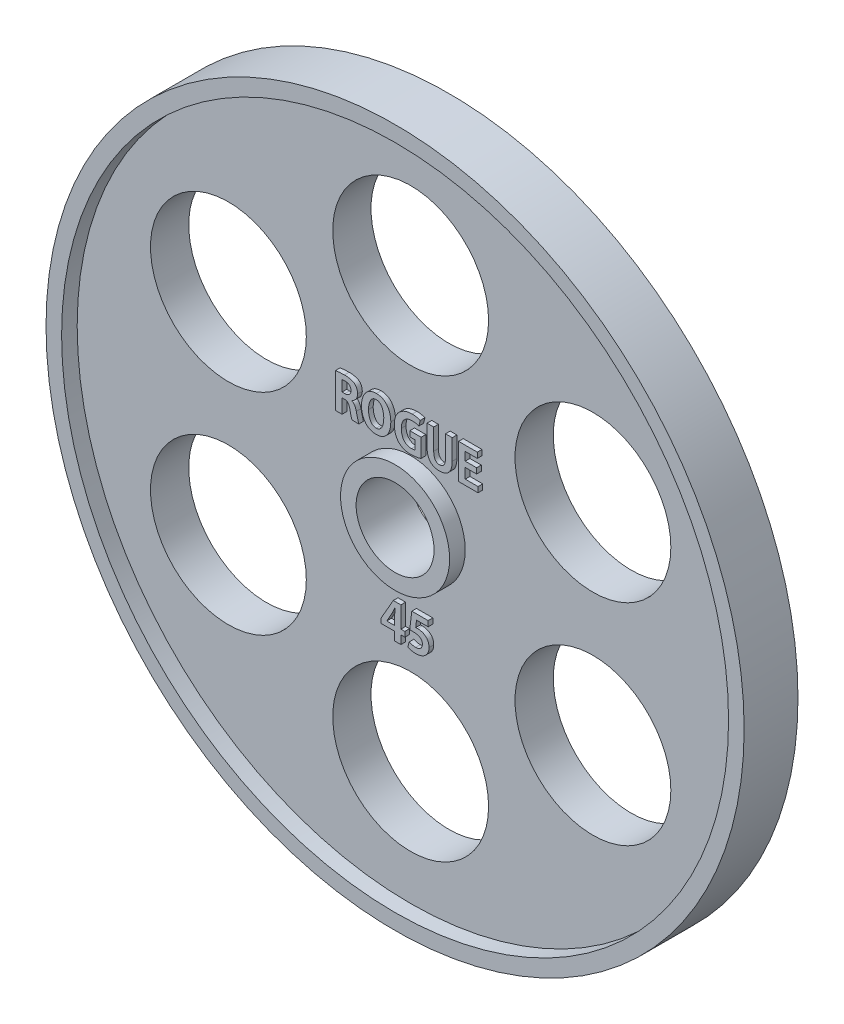
from build123d import *

# Parameters (mm, degrees)
SKETCH1_R               = 224
SKETCH1_R_2             = 25
BOSS_EXTRUDE1_DEPTH     = 17.272
SKETCH2_R               = 214
SKETCH2_R_2             = 35
CUT_EXTRUDE1_DEPTH      = 10
CUT_EXTRUDE2_DEPTH      = 318.733233918
CUT_EXTRUDE2_DEPTH_BACK = 318.733233918
SKETCH3_R               = 50
BOSS_EXTRUDE2_DEPTH     = 3


with BuildPart() as part:
    # Sketch1 → Boss-Extrude1 (new, symmetric)
    with BuildSketch(Plane.XY):
        Circle(SKETCH1_R)
        Circle(SKETCH1_R_2, mode=Mode.SUBTRACT)
    extrude(amount=BOSS_EXTRUDE1_DEPTH, both=True)

    # Sketch2 → Cut-Extrude1 (cut)
    with BuildSketch(Plane.XY.offset(17.272)):
        Circle(SKETCH2_R)
        Circle(SKETCH2_R_2, mode=Mode.SUBTRACT)
    extrude(amount=-CUT_EXTRUDE1_DEPTH, mode=Mode.SUBTRACT)

    # Sketch3 → Cut-Extrude2 (cut, two sides: drawn at the far end of the back side and taken through both)
    with BuildSketch(Plane.XY.offset(7.272).offset(-CUT_EXTRUDE2_DEPTH_BACK)):
        with Locations((0, 135.049061033)):
            Circle(SKETCH3_R)
        with Locations((116.955917612, 67.524530516)):
            Circle(SKETCH3_R)
        with Locations((116.955917612, -67.524530516)):
            Circle(SKETCH3_R)
        with Locations((0, -135.049061033)):
            Circle(SKETCH3_R)
        with Locations((-116.955917612, -67.524530516)):
            Circle(SKETCH3_R)
        with Locations((-116.955917612, 67.524530516)):
            Circle(SKETCH3_R)
    extrude(amount=CUT_EXTRUDE2_DEPTH + CUT_EXTRUDE2_DEPTH_BACK, mode=Mode.SUBTRACT)

    # Sketch4 → Boss-Extrude2 (add)
    # profile 1 of 7: a face of its own
    with BuildSketch(Plane.XY.offset(7.272)):
        Polygon((-0.729760641, -64.783991766), (-0.729760641, -61.581212386), (-3.263971384, -61.581212386), (-3.263971384, -48.102699124), (-8.128490856, -48.102699124), (-16.138927113, -62.038586506), (-16.138927113, -64.783991766), (-7.254625082, -64.783991766), (-7.254625082, -70.178139579), (-3.263971384, -70.178139579), (-3.263971384, -64.783991766), align=None)
        with BuildLine():
            add(Edge.make_bspline(
                [(-9.060614348, -55.820957862), (-8.89815638, -55.501607627), (-8.573533112, -54.863482464), (-8.123898036, -53.878632946), (-7.672922402, -52.865658152), (-7.358712998, -52.183255973), (-7.197815988, -51.833818721)],
                knots=[0, 0, 0, 0, 0.976764423, 1.951769216, 2.951163759, 4, 4, 4, 4], degree=3))
            Line((-7.197815988, -51.833818721), (-7.079851928, -51.831193091))
            add(Edge.make_bspline(
                [(-7.079851928, -51.831193091), (-7.126170714, -52.520143902), (-7.218214105, -53.889207629), (-7.244003181, -55.26111613), (-7.25681448, -55.942642251)],
                knots=[0, 0, 0, 0, 1.006455431, 2, 2, 2, 2], degree=3))
            Line((-7.25681448, -55.942642251), (-7.254625082, -61.581212386))
            Line((-7.254625082, -61.581212386), (-12.29391771, -61.581212386))
            Line((-12.29391771, -61.581212386), (-12.29391771, -61.521209735))
            Line((-12.29391771, -61.521209735), (-9.060614348, -55.820957862))
        make_face(mode=Mode.SUBTRACT)
    # profile 2 of 7: a face of its own
    with BuildSketch(Plane.XY.offset(7.272)):
        with BuildLine():
            add(Edge.make_bspline(
                [(2.379360279, -59.23721581), (2.559579298, -59.216358066), (2.938471092, -59.172506825), (3.532540352, -59.135035855), (4.177287829, -59.101641828), (4.622899626, -59.09994457), (4.854733032, -59.099061557)],
                knots=[0, 0, 0, 0, 0.877454455, 1.844756985, 2.878716113, 4, 4, 4, 4], degree=3))
            add(Edge.make_bspline(
                [(4.854733032, -59.099061557), (5.080989396, -59.10211444), (5.520052296, -59.108038726), (6.157616705, -59.158861274), (6.751381372, -59.242672102), (7.303991216, -59.355254428), (7.812791258, -59.501736346), (8.281436233, -59.67937668), (8.708420394, -59.887738259), (9.089837497, -60.134764703), (9.429954537, -60.407980364), (9.723273344, -60.714933789), (9.973074694, -61.048437776), (10.178440086, -61.410482449), (10.333708042, -61.802528085), (10.448419054, -62.221990978), (10.515361186, -62.670564206), (10.525861767, -62.978695119), (10.531230769, -63.136244061)],
                knots=[0, 0, 0, 0, 1.376975805, 2.672097174, 3.889715345, 5.024935981, 6.101897443, 7.108622118, 8.072196835, 8.987646619, 9.868961103, 10.721607246, 11.564639608, 12.399262134, 13.247093457, 14.1244591, 15.041026163, 16, 16, 16, 16], degree=3))
            add(Edge.make_bspline(
                [(10.531230769, -63.136244061), (10.523058413, -63.286880314), (10.507085227, -63.581304684), (10.432041756, -64.00807688), (10.330997718, -64.411264541), (10.180871979, -64.783078556), (9.997726406, -65.12945145), (9.779149199, -65.450624894), (9.520064898, -65.743748283), (9.224101576, -66.002824757), (8.904010678, -66.233724235), (8.565617006, -66.436556164), (8.212412643, -66.610632098), (7.842442157, -66.74690259), (7.461712287, -66.867101), (7.06046104, -66.936077496), (6.647298729, -66.992046532), (6.366426644, -66.997756663), (6.224340875, -67.000645267)],
                knots=[0, 0, 0, 0, 1.117583691, 2.184360454, 3.207534369, 4.193945161, 5.149122039, 6.108265851, 7.067522763, 8.041482217, 9.018611016, 9.990340196, 10.963909721, 11.93306774, 12.911749652, 13.918839882, 14.947196064, 16, 16, 16, 16], degree=3))
            add(Edge.make_bspline(
                [(6.224340875, -67.000645267), (6.013473837, -66.99500088), (5.597844617, -66.983875517), (4.986800857, -66.919530955), (4.399845454, -66.818901558), (3.842490249, -66.682702097), (3.323666611, -66.530129827), (2.851866447, -66.363676994), (2.43213169, -66.195988197), (2.176551499, -66.066781086), (2.056518854, -66.006099264)],
                knots=[0, 0, 0, 0, 1.17104461, 2.308186058, 3.408530927, 4.475634886, 5.492545615, 6.410316856, 7.253408985, 8, 8, 8, 8], degree=3))
            Line((2.056518854, -66.006099264), (1.214205915, -69.272087198))
            add(Edge.make_bspline(
                [(1.214205915, -69.272087198), (1.363191124, -69.348995251), (1.676368677, -69.510661472), (2.196057613, -69.714959315), (2.782697668, -69.901851195), (3.431591554, -70.077757556), (4.132156302, -70.232001255), (4.876691775, -70.330758892), (5.653812217, -70.409031539), (6.184792397, -70.417983419), (6.456120664, -70.422557786)],
                knots=[0, 0, 0, 0, 0.742744707, 1.56130243, 2.470949386, 3.470792521, 4.54051912, 5.647308622, 6.797786247, 8, 8, 8, 8], degree=3))
            add(Edge.make_bspline(
                [(6.456120664, -70.422557786), (6.774012692, -70.409607099), (7.393776054, -70.384358397), (8.295395465, -70.258547525), (9.144462304, -70.07547066), (9.941409611, -69.827727478), (10.68364529, -69.511378566), (11.369985643, -69.124491469), (12.005829161, -68.677451563), (12.582253299, -68.165853445), (13.098116991, -67.608878026), (13.547790717, -67.013382942), (13.935759145, -66.389389475), (14.244459114, -65.727885737), (14.499088618, -65.041661337), (14.673173956, -64.320169842), (14.786005396, -63.568180767), (14.803804761, -63.055177336), (14.812835596, -62.794895644)],
                knots=[0, 0, 0, 0, 1.206264818, 2.351737923, 3.448157932, 4.498117667, 5.51266174, 6.502772445, 7.481504261, 8.455495724, 9.420819422, 10.356539462, 11.282329499, 12.2023817, 13.121090432, 14.054197148, 15.012761268, 16, 16, 16, 16], degree=3))
            add(Edge.make_bspline(
                [(14.812835596, -62.794895644), (14.797478673, -62.51222116), (14.767710106, -61.964271945), (14.653507551, -61.1708705), (14.458790621, -60.437702852), (14.216943495, -59.755052095), (13.893235355, -59.13547305), (13.520761148, -58.562850122), (13.069360225, -58.056593779), (12.559738695, -57.610050673), (12.009622794, -57.217354726), (11.430494326, -56.873887731), (10.823518412, -56.585686594), (10.191159273, -56.351644511), (9.534448335, -56.161412278), (8.850578217, -56.039945023), (8.142277058, -55.960396865), (7.661602009, -55.951423563), (7.416953243, -55.946856429)],
                knots=[0, 0, 0, 0, 1.197180487, 2.32066969, 3.382793817, 4.401622341, 5.376880326, 6.332686038, 7.284030491, 8.235374944, 9.193394283, 10.139043906, 11.079883983, 12.031228436, 12.988584225, 13.967509591, 14.965525106, 16, 16, 16, 16], degree=3))
            add(Edge.make_bspline(
                [(7.416953243, -55.946856429), (7.205922909, -55.949518037), (6.796758867, -55.954678597), (6.39121992, -56.009033387), (6.194841629, -56.035354166)],
                knots=[0, 0, 0, 0, 1.03151945, 2, 2, 2, 2], degree=3))
            Line((6.194841629, -56.035354166), (6.777818006, -51.568333739))
            Line((6.777818006, -51.568333739), (14.213364663, -51.568333739))
            Line((14.213364663, -51.568333739), (14.213364663, -48.095846969))
            Line((14.213364663, -48.095846969), (3.719287799, -48.095846969))
            Line((3.719287799, -48.095846969), (2.379360279, -59.23721581))
        make_face()
    # profile 3 of 7: a face of its own
    with BuildSketch(Plane.XY.offset(7.272)):
        with BuildLine():
            Line((-45.293989032, 38.929293911), (-41.01238009, 38.929293911))
            Line((-41.01238009, 38.929293911), (-41.01238009, 48.099345193))
            Line((-41.01238009, 48.099345193), (-39.55881792, 48.099345193))
            add(Edge.make_bspline(
                [(-39.55881792, 48.099345193), (-39.437815461, 48.098476083), (-39.202425845, 48.096785376), (-38.859864098, 48.062145358), (-38.537616803, 48.004936635), (-38.236208207, 47.916595015), (-37.957468527, 47.797080391), (-37.697539552, 47.655495272), (-37.465064598, 47.479359237), (-37.249790423, 47.278932435), (-37.054219309, 47.040970145), (-36.867414092, 46.767669617), (-36.702926658, 46.447831813), (-36.539234562, 46.094256568), (-36.401008327, 45.695699295), (-36.26266184, 45.261637895), (-36.147839467, 44.783223066), (-36.079398941, 44.450066535), (-36.043864253, 44.277089882)],
                knots=[0, 0, 0, 0, 1.001974666, 1.949170552, 2.84847504, 3.710096242, 4.544408109, 5.357094972, 6.155407276, 6.953973995, 7.788367017, 8.701791117, 9.690949389, 10.763842173, 11.927092208, 13.182233812, 14.537000723, 16, 16, 16, 16], degree=3))
            add(Edge.make_bspline(
                [(-36.043864253, 44.277089882), (-35.979223158, 43.946690532), (-35.854957786, 43.311534243), (-35.654751335, 42.405067036), (-35.468885005, 41.580189444), (-35.27839547, 40.849462984), (-35.105055047, 40.21322004), (-34.939353361, 39.68629776), (-34.802930473, 39.263507848), (-34.698291628, 39.027023773), (-34.65318552, 38.925083848)],
                knots=[0, 0, 0, 0, 1.458923133, 2.804618726, 4.022904405, 5.122896265, 6.077023435, 6.879967071, 7.517193397, 8, 8, 8, 8], degree=3))
            Line((-34.65318552, 38.925083848), (-30.246731556, 38.929293911))
            add(Edge.make_bspline(
                [(-30.246731556, 38.929293911), (-30.3060426, 39.064700631), (-30.442577902, 39.376409822), (-30.612432814, 39.924071949), (-30.809579765, 40.597484267), (-31.006652034, 41.386538024), (-31.219786513, 42.260347176), (-31.434834061, 43.190532175), (-31.670396691, 44.159631722), (-31.823299056, 44.820567953), (-31.9013273, 45.157853079)],
                knots=[0, 0, 0, 0, 0.549570025, 1.265122049, 2.130097267, 3.160546163, 4.289861562, 5.476300611, 6.712120432, 8, 8, 8, 8], degree=3))
            add(Edge.make_bspline(
                [(-31.9013273, 45.157853079), (-31.966947557, 45.434473949), (-32.093197373, 45.966677506), (-32.350183791, 46.716353481), (-32.637391212, 47.394459062), (-32.969868191, 47.997188222), (-33.348655938, 48.526007817), (-33.794246177, 48.965189694), (-34.295208362, 49.327652344), (-34.668117874, 49.497439563), (-34.855466063, 49.582739957)],
                knots=[0, 0, 0, 0, 1.229855108, 2.366174558, 3.425587808, 4.413573034, 5.340237738, 6.230192189, 7.110855911, 8, 8, 8, 8], degree=3))
            Line((-34.855466063, 49.582739957), (-34.851918581, 49.671636889))
            add(Edge.make_bspline(
                [(-34.851918581, 49.671636889), (-34.59188174, 49.784436065), (-34.072936678, 50.009544842), (-33.367023977, 50.489656291), (-32.718928436, 51.059167328), (-32.239877076, 51.612758721), (-31.904227275, 52.104441371), (-31.680985661, 52.495951137), (-31.489455576, 52.907139242), (-31.334730686, 53.339492926), (-31.206902715, 53.791055609), (-31.115301504, 54.264705458), (-31.055081927, 54.757675076), (-31.043362026, 55.093308172), (-31.037420814, 55.263451873)],
                knots=[0, 0, 0, 0, 1.415251057, 2.824359598, 4.248283838, 5.723142377, 6.47158846, 7.223785845, 7.975195039, 8.737661918, 9.518558112, 10.320635523, 11.148673685, 12, 12, 12, 12], degree=3))
            add(Edge.make_bspline(
                [(-31.037420814, 55.263451873), (-31.049366549, 55.437847856), (-31.072842062, 55.780567267), (-31.142921179, 56.279214981), (-31.225971219, 56.75494302), (-31.329960376, 57.204214635), (-31.457587477, 57.628960268), (-31.604188522, 58.029158208), (-31.77155153, 58.404631877), (-31.963341287, 58.753275431), (-32.174129912, 59.076409607), (-32.399682751, 59.380034892), (-32.657088054, 59.647685666), (-32.92581233, 59.900922224), (-33.222016968, 60.121625044), (-33.5359789, 60.323250106), (-33.872887866, 60.49439342), (-34.343449552, 60.687238298), (-34.940480797, 60.884705847), (-35.643439041, 61.105292172), (-36.335902406, 61.270689931), (-37.006885614, 61.409491918), (-37.66323139, 61.499159206), (-38.301220608, 61.563736482), (-38.923834718, 61.574313237), (-39.332393016, 61.555860801), (-39.53320362, 61.546791239)],
                knots=[0, 0, 0, 0, 1.04254728, 2.048792541, 3.00224853, 3.923105087, 4.79804786, 5.646501919, 6.464227683, 7.248100506, 8.017504481, 8.765055913, 9.500244792, 10.229727568, 10.965537121, 11.700200404, 12.45355415, 13.216173449, 14.732128481, 16.203485081, 17.610025167, 18.977448705, 20.289434687, 21.560307215, 22.800865913, 24, 24, 24, 24], degree=3))
            add(Edge.make_bspline(
                [(-39.53320362, 61.546791239), (-40.069969333, 61.540480772), (-41.119115816, 61.528146519), (-42.407277946, 61.44351606), (-43.384193499, 61.352164672), (-44.061451987, 61.276837957), (-44.69531954, 61.19362222), (-45.10168099, 61.127736707), (-45.298199095, 61.095874195)],
                knots=[0, 0, 0, 0, 1.668967631, 3.262115064, 4.012317135, 4.719957541, 5.380966089, 6, 6, 6, 6], degree=3))
            Line((-45.298199095, 61.095874195), (-45.293989032, 38.929293911))
        make_face()
        with BuildLine():
            add(Edge.make_bspline(
                [(-41.01238009, 58.172201799), (-40.906053913, 58.199456325), (-40.656947617, 58.263309593), (-40.216802022, 58.308166538), (-39.664468623, 58.343127216), (-39.257982404, 58.343701992), (-39.035930618, 58.344015975)],
                knots=[0, 0, 0, 0, 0.661277559, 1.549274193, 2.661238647, 4, 4, 4, 4], degree=3))
            add(Edge.make_bspline(
                [(-39.035930618, 58.344015975), (-38.82754405, 58.345205425), (-38.408793399, 58.347595612), (-37.784867572, 58.226562492), (-37.171611157, 58.016064536), (-36.675002658, 57.771224094), (-36.302901244, 57.512741982), (-36.054672595, 57.26811031), (-35.844470224, 56.977862097), (-35.663359666, 56.64479989), (-35.530642164, 56.263274035), (-35.417550246, 55.84299865), (-35.348263379, 55.376433215), (-35.329047663, 55.050140662), (-35.319025641, 54.879961677)],
                knots=[0, 0, 0, 0, 1.292083092, 2.596427594, 3.923894466, 5.313341569, 6.020452472, 6.730143688, 7.466744382, 8.239869291, 9.076443159, 9.969725277, 10.941103348, 12, 12, 12, 12], degree=3))
            add(Edge.make_bspline(
                [(-35.319025641, 54.879961677), (-35.323790603, 54.747748353), (-35.333101469, 54.489399904), (-35.38475779, 54.1129333), (-35.464116483, 53.755487914), (-35.576488039, 53.418275719), (-35.726993068, 53.102620396), (-35.906755793, 52.807862232), (-36.121628119, 52.536234482), (-36.360376838, 52.282289604), (-36.630820926, 52.055342157), (-36.92631448, 51.855217775), (-37.251933139, 51.691002405), (-37.600213892, 51.552601754), (-37.975279943, 51.441814597), (-38.374628956, 51.36385937), (-38.800019358, 51.311652077), (-39.091960336, 51.302584025), (-39.242425339, 51.297910394)],
                knots=[0, 0, 0, 0, 1.059346065, 2.069991167, 3.039184971, 3.989375718, 4.910601955, 5.835121727, 6.749101981, 7.680445877, 8.622807178, 9.571664136, 10.532985652, 11.538164881, 12.57081342, 13.661090204, 14.794536924, 16, 16, 16, 16], degree=3))
            Line((-39.242425339, 51.297910394), (-41.01238009, 51.302120457))
            Line((-41.01238009, 51.302120457), (-41.01238009, 58.172201799))
        make_face(mode=Mode.SUBTRACT)
    # profile 4 of 7: a face of its own
    with BuildSketch(Plane.XY.offset(7.272)):
        with BuildLine():
            add(Edge.make_bspline(
                [(-18.989011896, 61.551001302), (-19.350720411, 61.532795325), (-20.058165552, 61.49718729), (-21.086040133, 61.325574869), (-22.054683661, 61.065737401), (-22.964237324, 60.706808352), (-23.811028535, 60.243313277), (-24.599469697, 59.687370008), (-25.331444889, 59.039147842), (-25.987842574, 58.290229534), (-26.58202958, 57.469076841), (-27.101686884, 56.581493299), (-27.540269003, 55.6321505), (-27.902682959, 54.625116619), (-28.190495205, 53.558469037), (-28.394285127, 52.430691093), (-28.522177846, 51.243191588), (-28.544079486, 50.431519024), (-28.555269985, 50.016800289)],
                knots=[0, 0, 0, 0, 1.033979396, 2.022301571, 2.970529521, 3.894611869, 4.808705929, 5.721706953, 6.645545269, 7.595046225, 8.560760165, 9.537443814, 10.528556773, 11.544132656, 12.591621816, 13.681030908, 14.81513806, 16, 16, 16, 16], degree=3))
            add(Edge.make_bspline(
                [(-28.555269985, 50.016800289), (-28.547008284, 49.61332964), (-28.530822838, 48.82289282), (-28.409187036, 47.667049294), (-28.222547853, 46.56630367), (-27.957074921, 45.521634479), (-27.615919885, 44.533382823), (-27.201290165, 43.60141201), (-26.715578018, 42.724140831), (-26.157204472, 41.908550723), (-25.532612975, 41.163276054), (-24.832391811, 40.512642784), (-24.063834467, 39.963793967), (-23.235787239, 39.502267455), (-22.338349472, 39.144544681), (-21.377549333, 38.879881977), (-20.35189976, 38.708211853), (-19.645766172, 38.6760594), (-19.284078431, 38.659590636)],
                knots=[0, 0, 0, 0, 1.175398352, 2.302715549, 3.382711972, 4.426044826, 5.439559783, 6.425314094, 7.394529886, 8.35725084, 9.301097905, 10.222100453, 11.134210928, 12.046578501, 12.977639436, 13.941864418, 14.945805126, 16, 16, 16, 16], degree=3))
            add(Edge.make_bspline(
                [(-19.284078431, 38.659590636), (-18.938026981, 38.668109705), (-18.258487685, 38.684838554), (-17.267554191, 38.827373448), (-16.326549267, 39.054349295), (-15.437695434, 39.374117416), (-14.600862654, 39.792390923), (-13.813029823, 40.297029507), (-13.08579228, 40.905104265), (-12.403336668, 41.59008698), (-11.790896403, 42.372771728), (-11.258083302, 43.24937627), (-10.801910735, 44.21539992), (-10.429810584, 45.272476235), (-10.134682139, 46.417409434), (-9.923023039, 47.652106671), (-9.788116732, 48.977256), (-9.761238707, 49.891453778), (-9.747393665, 50.362362883)],
                knots=[0, 0, 0, 0, 0.973215927, 1.911098665, 2.810233662, 3.692878859, 4.562482505, 5.437306462, 6.318818337, 7.224297875, 8.153278156, 9.107653746, 10.104740014, 11.153537043, 12.255914066, 13.4274303, 14.674852943, 16, 16, 16, 16], degree=3))
            add(Edge.make_bspline(
                [(-9.747393665, 50.362362883), (-9.752857369, 50.739127787), (-9.763605196, 51.480274002), (-9.878330943, 52.568381378), (-10.052732938, 53.613846821), (-10.300631028, 54.61664761), (-10.626474306, 55.576000155), (-11.023169878, 56.49177097), (-11.488394208, 57.36594244), (-12.024804398, 58.189479018), (-12.630389002, 58.950381248), (-13.318978365, 59.618746884), (-14.084031544, 60.188090227), (-14.924743642, 60.657930733), (-15.838683202, 61.028508971), (-16.822844747, 61.308321725), (-17.88193964, 61.484580345), (-18.613374404, 61.52567989), (-18.989085973, 61.546791239)],
                knots=[0, 0, 0, 0, 1.108815589, 2.181186377, 3.217324289, 4.227359111, 5.218662007, 6.196651342, 7.162419235, 8.130521869, 9.086401898, 10.019355721, 10.947374437, 11.886103195, 12.846837522, 13.844349182, 14.892720183, 16, 16, 16, 16], degree=3))
            Line((-18.989085973, 61.546791239), (-18.989011896, 61.551001302))
        make_face()
        with BuildLine():
            add(Edge.make_bspline(
                [(-19.105774256, 58.078514532), (-18.906166825, 58.060414615), (-18.517064061, 58.025131723), (-17.954539097, 57.899954382), (-17.43268502, 57.698491471), (-16.951590978, 57.428709866), (-16.509831141, 57.088574613), (-16.108656827, 56.681872776), (-15.748749199, 56.205196486), (-15.436384246, 55.66430173), (-15.164833568, 55.077194657), (-14.915943023, 54.461698719), (-14.717699572, 53.814538528), (-14.546675123, 53.14290023), (-14.417450841, 52.443087484), (-14.325117307, 51.71574364), (-14.269236615, 50.961664291), (-14.263626311, 50.449551788), (-14.260778281, 50.189581586)],
                knots=[0, 0, 0, 0, 0.936463798, 1.82548641, 2.684127786, 3.542744044, 4.395260201, 5.282267079, 6.205678022, 7.180000722, 8.196506421, 9.228258241, 10.281381103, 11.358157126, 12.467215955, 13.606035564, 14.784721301, 16, 16, 16, 16], degree=3))
            add(Edge.make_bspline(
                [(-14.260778281, 50.189581586), (-14.264970427, 49.908528472), (-14.273196459, 49.357032548), (-14.333361053, 48.548263057), (-14.428379299, 47.777092292), (-14.564353037, 47.042694348), (-14.735169897, 46.345491441), (-14.944562534, 45.683703001), (-15.201088022, 45.063611458), (-15.481703848, 44.479145318), (-15.803831208, 43.946739498), (-16.167909144, 43.479179132), (-16.569018492, 43.077491726), (-17.013538267, 42.751996686), (-17.488243002, 42.484616051), (-18.005190815, 42.296316845), (-18.557767544, 42.170577032), (-18.940644592, 42.145107395), (-19.136582202, 42.13207329)],
                knots=[0, 0, 0, 0, 1.289934008, 2.531170484, 3.720374072, 4.854740059, 5.957213729, 7.013449117, 8.037165448, 9.034886746, 9.986980833, 10.887254569, 11.74895182, 12.583294381, 13.408695019, 14.241067112, 15.099864807, 16, 16, 16, 16], degree=3))
            add(Edge.make_bspline(
                [(-19.136582202, 42.13207329), (-19.331063529, 42.145227254), (-19.711058509, 42.170928643), (-20.262030048, 42.295370085), (-20.77400957, 42.491152168), (-21.254316961, 42.749946681), (-21.692866526, 43.083953632), (-22.102705319, 43.478362398), (-22.469419518, 43.94670038), (-22.793496388, 44.479255312), (-23.086835861, 45.056932924), (-23.339917787, 45.676244391), (-23.553179895, 46.328795682), (-23.731325394, 47.01548669), (-23.869298063, 47.737709562), (-23.97014788, 48.494538324), (-24.029318919, 49.286803137), (-24.037634836, 49.825657808), (-24.04188537, 50.101083848)],
                knots=[0, 0, 0, 0, 0.900670226, 1.759809896, 2.600946146, 3.429642157, 4.274359804, 5.142859609, 6.05415538, 7.017062466, 8.022526562, 9.048195907, 10.108477395, 11.19592731, 12.327557226, 13.507517, 14.726011367, 16, 16, 16, 16], degree=3))
            add(Edge.make_bspline(
                [(-24.04188537, 50.101083848), (-24.039087608, 50.36246302), (-24.033590911, 50.87598872), (-23.977216492, 51.632813538), (-23.88546807, 52.36307022), (-23.75486827, 53.068104203), (-23.587245218, 53.746812133), (-23.380023857, 54.398495348), (-23.135173672, 55.023637545), (-22.855977851, 55.618289628), (-22.543125281, 56.172178356), (-22.173663686, 56.654730867), (-21.765783246, 57.070102723), (-21.314681356, 57.414976643), (-20.822668085, 57.691174792), (-20.28778107, 57.895775832), (-19.7112984, 58.026895761), (-19.311425032, 58.058273849), (-19.107082956, 58.074308585)],
                knots=[0, 0, 0, 0, 1.205088424, 2.367609753, 3.497237102, 4.597454418, 5.672031744, 6.718840175, 7.748493441, 8.765539111, 9.746550106, 10.675452162, 11.559455099, 12.42358487, 13.284893858, 14.152222325, 15.055754259, 16, 16, 16, 16], degree=3))
            Line((-19.107082956, 58.074308585), (-19.105774256, 58.078514532))
        make_face(mode=Mode.SUBTRACT)
    # profile 5 of 7: a face of its own
    with BuildSketch(Plane.XY.offset(7.272)):
        with BuildLine():
            Line((2.446828281, 51.54654278), (2.446828281, 48.124630261))
            Line((2.446828281, 48.124630261), (5.680703685, 48.124630261))
            Line((5.680703685, 48.124630261), (5.680703685, 42.463310149))
            add(Edge.make_bspline(
                [(5.680703685, 42.463310149), (5.6251371, 42.43693824), (5.507211783, 42.38097087), (5.303947183, 42.326731883), (5.074084465, 42.27060532), (4.812047532, 42.226032787), (4.519910855, 42.18644255), (4.196031334, 42.165165982), (3.84079551, 42.141708238), (3.593333215, 42.135379527), (3.464054299, 42.13207329)],
                knots=[0, 0, 0, 0, 0.653154628, 1.386147199, 2.230860804, 3.172021168, 4.212071664, 5.366447579, 6.624183111, 8, 8, 8, 8], degree=3))
            add(Edge.make_bspline(
                [(3.464054299, 42.13207329), (3.233282747, 42.136736827), (2.779434711, 42.145908394), (2.117889869, 42.247743161), (1.486181294, 42.400601369), (0.890511823, 42.628340902), (0.32249495, 42.90830555), (-0.208314385, 43.259636111), (-0.70763454, 43.669831859), (-1.172025907, 44.143511614), (-1.595250072, 44.677334085), (-1.958099068, 45.279636677), (-2.271658012, 45.939798246), (-2.52517605, 46.664192483), (-2.734058281, 47.445426033), (-2.876484905, 48.28933585), (-2.97648602, 49.192752641), (-2.995105964, 49.817043531), (-3.004708899, 50.13901145)],
                knots=[0, 0, 0, 0, 0.953676512, 1.87555272, 2.761867879, 3.637011316, 4.507417159, 5.37595959, 6.263416516, 7.1754643, 8.114589267, 9.074123104, 10.077253866, 11.132050585, 12.243927563, 13.417825685, 14.668285404, 16, 16, 16, 16], degree=3))
            add(Edge.make_bspline(
                [(-3.004708899, 50.13901145), (-2.993861212, 50.458187136), (-2.972824405, 51.077161273), (-2.866745887, 51.971829778), (-2.704337826, 52.802527018), (-2.482235278, 53.565945972), (-2.20398319, 54.266980861), (-1.86175146, 54.899483711), (-1.465511819, 55.472990983), (-1.000272101, 55.96988446), (-0.493875363, 56.407665387), (0.046706822, 56.790408267), (0.626324455, 57.107696397), (1.23737488, 57.3689567), (1.883667738, 57.573187547), (2.564150819, 57.71451745), (3.279176719, 57.801138121), (3.767223902, 57.809013414), (4.016111614, 57.81302955)],
                knots=[0, 0, 0, 0, 1.298542789, 2.518250729, 3.66010011, 4.737713637, 5.747803493, 6.721842567, 7.65708385, 8.574936643, 9.482253959, 10.376304947, 11.263703582, 12.164756428, 13.075521448, 14.015723889, 14.988085666, 16, 16, 16, 16], degree=3))
            add(Edge.make_bspline(
                [(4.016111614, 57.81302955), (4.250746008, 57.809237638), (4.702143361, 57.801942632), (5.350906878, 57.762258467), (5.942458925, 57.688566141), (6.482393914, 57.599462928), (6.973909494, 57.475994855), (7.430484071, 57.350023326), (7.848774674, 57.19692439), (8.111452255, 57.081096283), (8.238717949, 57.024978268)],
                knots=[0, 0, 0, 0, 1.300829087, 2.50257772, 3.600788493, 4.604486954, 5.533740486, 6.408714025, 7.229031605, 8, 8, 8, 8], degree=3))
            Line((8.238717949, 57.024978268), (9.123629478, 60.597094954))
            add(Edge.make_bspline(
                [(9.123629478, 60.597094954), (8.978263344, 60.662442645), (8.671969682, 60.800133475), (8.172730319, 60.983502332), (7.60398447, 61.133505022), (6.976688688, 61.278133433), (6.291764587, 61.395332131), (5.557352806, 61.478336358), (4.775343862, 61.528436844), (4.238132424, 61.537768701), (3.9613273, 61.542577061)],
                knots=[0, 0, 0, 0, 0.723254479, 1.523933104, 2.410192463, 3.390746967, 4.445142521, 5.561749782, 6.743660119, 8, 8, 8, 8], degree=3))
            add(Edge.make_bspline(
                [(3.9613273, 61.542577061), (3.557734751, 61.532640626), (2.766214665, 61.513153427), (1.607056892, 61.366744068), (0.503012612, 61.131396722), (-0.548714641, 60.806327367), (-1.546712076, 60.390003844), (-2.487332995, 59.874627188), (-3.376683102, 59.274645657), (-4.068226766, 58.700574609), (-4.584553834, 58.195695241), (-4.950121798, 57.795992371), (-5.294914486, 57.377462004), (-5.608845312, 56.934952304), (-5.900887881, 56.473237543), (-6.17126164, 55.993017855), (-6.416115124, 55.49063797), (-6.633812158, 54.96613329), (-6.834592768, 54.423586572), (-6.999869651, 53.857578074), (-7.147982711, 53.274380062), (-7.276723235, 52.672021444), (-7.370295014, 52.046678335), (-7.447511538, 51.401823389), (-7.49853246, 50.735351028), (-7.511510534, 50.283781417), (-7.518093514, 50.054727891)],
                knots=[0, 0, 0, 0, 1.588252423, 3.114858529, 4.590810091, 6.026612173, 7.441653233, 8.839609889, 10.241268389, 11.658554554, 12.370162762, 13.082415096, 13.78967092, 14.503124065, 15.216405789, 15.939266766, 16.671226771, 17.414686674, 18.173812935, 18.947024519, 19.734205331, 20.542085796, 21.370222467, 22.222016626, 23.098138246, 24, 24, 24, 24], degree=3))
            add(Edge.make_bspline(
                [(-7.518093514, 50.054727891), (-7.506584992, 49.607645555), (-7.484047101, 48.732094973), (-7.336535741, 47.450000697), (-7.086323625, 46.231306412), (-6.80167807, 45.259947983), (-6.526753333, 44.521296673), (-6.297194361, 43.995962365), (-6.049572405, 43.494585706), (-5.780168114, 43.017101025), (-5.486783759, 42.56656543), (-5.182447748, 42.133964916), (-4.846652597, 41.732576872), (-4.607473093, 41.481817536), (-4.488099548, 41.356664542)],
                knots=[0, 0, 0, 0, 1.704842656, 3.338704885, 4.913464543, 6.443981355, 7.193187298, 7.917665265, 8.629154765, 9.324799911, 10.00680261, 10.678695983, 11.34054239, 12, 12, 12, 12], degree=3))
            add(Edge.make_bspline(
                [(-4.488099548, 41.356664542), (-4.247325678, 41.136918724), (-3.765115623, 40.696822615), (-2.945836823, 40.145883082), (-2.059278428, 39.679914216), (-1.102158167, 39.301410391), (-0.074805491, 39.005565661), (1.02259299, 38.797631232), (2.191252962, 38.672906218), (2.993152111, 38.664109275), (3.405055807, 38.659590636)],
                knots=[0, 0, 0, 0, 0.913036649, 1.828584863, 2.758893342, 3.717094375, 4.709404796, 5.752305212, 6.845448596, 8, 8, 8, 8], degree=3))
            add(Edge.make_bspline(
                [(3.405055807, 38.659590636), (3.72267031, 38.666198333), (4.347439156, 38.679196112), (5.26693894, 38.753630757), (6.154391273, 38.861854429), (7.000417711, 39.008468083), (7.788119568, 39.18019706), (8.499174277, 39.360566127), (9.126100947, 39.542684691), (9.509205812, 39.681786545), (9.688395173, 39.746848554)],
                knots=[0, 0, 0, 0, 1.189863118, 2.340539873, 3.45407261, 4.538092694, 5.555811396, 6.473485662, 7.286004554, 8, 8, 8, 8], degree=3))
            Line((9.688395173, 39.746848554), (9.692605236, 51.54654278))
            Line((9.692605236, 51.54654278), (2.446828281, 51.54654278))
        make_face()
    # profile 6 of 7: a face of its own
    with BuildSketch(Plane.XY.offset(7.272)):
        with BuildLine():
            Line((25.369343202, 61.281293911), (25.369343202, 47.769499343))
            add(Edge.make_bspline(
                [(25.369343202, 47.769499343), (25.364685142, 47.529573249), (25.355705735, 47.067064428), (25.304697242, 46.400730945), (25.22694253, 45.785227282), (25.113501396, 45.220622191), (24.971232218, 44.704617851), (24.800378528, 44.237325725), (24.59335138, 43.822130674), (24.356377707, 43.455323646), (24.089795283, 43.138632497), (23.798823976, 42.863780077), (23.483845402, 42.631781539), (23.142012249, 42.444276742), (22.776638763, 42.300110112), (22.387351957, 42.200159019), (21.9732807, 42.138960059), (21.689190725, 42.134414406), (21.542877828, 42.13207329)],
                knots=[0, 0, 0, 0, 1.490335628, 2.872940429, 4.148958373, 5.341678511, 6.44675969, 7.471071941, 8.42710538, 9.322567927, 10.177224934, 10.992023476, 11.803545021, 12.600201061, 13.407112453, 14.236726727, 15.091873547, 16, 16, 16, 16], degree=3))
            add(Edge.make_bspline(
                [(21.542877828, 42.13207329), (21.403622872, 42.134669274), (21.130796591, 42.139755286), (20.73256443, 42.1984526), (20.357929797, 42.30525279), (20.004635757, 42.454724753), (19.670845742, 42.643738824), (19.360771765, 42.877664819), (19.075767045, 43.156986318), (18.809721051, 43.477588004), (18.568352996, 43.845242536), (18.362398083, 44.263622198), (18.184823565, 44.728845661), (18.044588789, 45.244750518), (17.93154446, 45.80656716), (17.847167172, 46.415803195), (17.79794585, 47.074512515), (17.788646918, 47.530352904), (17.783831071, 47.766429248)],
                knots=[0, 0, 0, 0, 0.874083262, 1.712491184, 2.51954072, 3.31419991, 4.116267761, 4.922593724, 5.746109999, 6.616982005, 7.534547127, 8.501142007, 9.539883987, 10.65717316, 11.854422601, 13.136974088, 14.517260191, 16, 16, 16, 16], degree=3))
            Line((17.783831071, 47.766429248), (17.783831071, 61.281293911))
            Line((17.783831071, 61.281293911), (13.502222129, 61.281293911))
            Line((13.502222129, 61.281293911), (13.502222129, 48.147265006))
            add(Edge.make_bspline(
                [(13.502222129, 48.147265006), (13.508673722, 47.751820869), (13.521153434, 46.986889053), (13.617187096, 45.880789858), (13.780054348, 44.85663822), (14.006961703, 43.913837594), (14.291415944, 43.049040445), (14.640259741, 42.262788509), (15.058161161, 41.559945068), (15.538600141, 40.937811129), (16.078379485, 40.393251424), (16.67672542, 39.92386423), (17.329964639, 39.522567411), (18.044709354, 39.205495937), (18.809546808, 38.947725151), (19.633731717, 38.78191327), (20.510135406, 38.670641758), (21.114058519, 38.663345708), (21.424880845, 38.659590636)],
                knots=[0, 0, 0, 0, 1.341228934, 2.594421284, 3.762393366, 4.855664785, 5.8802742, 6.846423615, 7.767372286, 8.64706517, 9.506232889, 10.361281592, 11.220964451, 12.099559776, 13.008148492, 13.952947907, 14.946439577, 16, 16, 16, 16], degree=3))
            add(Edge.make_bspline(
                [(21.424880845, 38.659590636), (21.7398367, 38.663715279), (22.353399121, 38.671750455), (23.24675596, 38.778668219), (24.086070116, 38.960090271), (24.872554271, 39.210751113), (25.603936436, 39.53864009), (26.283386122, 39.935141925), (26.907288974, 40.410957889), (27.473088805, 40.962244942), (27.986423401, 41.585446153), (28.4218253, 42.296084274), (28.800684701, 43.081393265), (29.104744377, 43.948715105), (29.344639263, 44.893659988), (29.514599644, 45.917065764), (29.619763036, 47.019772745), (29.637552447, 47.781639961), (29.646742081, 48.175204512)],
                knots=[0, 0, 0, 0, 1.052294924, 2.049965448, 3.001336543, 3.919006355, 4.803859469, 5.675191847, 6.542936471, 7.419566364, 8.310577297, 9.234341309, 10.19829392, 11.22007025, 12.300820344, 13.453312577, 14.684434938, 16, 16, 16, 16], degree=3))
            Line((29.646742081, 48.175204512), (29.650952144, 61.281293911))
            Line((29.650952144, 61.281293911), (25.369343202, 61.281293911))
        make_face()
    # profile 7 of 7: a face of its own
    with BuildSketch(Plane.XY.offset(7.272)):
        Polygon((38.01188537, 42.401780681), (38.01188537, 48.908467365), (45.323229008, 48.908467365), (45.323229008, 52.38095002), (38.01188537, 52.38095002), (38.01188537, 57.808807141), (45.760161894, 57.808807141), (45.760161894, 61.281293911), (33.730276428, 61.281293911), (33.730276428, 38.929298026), (46.22622364, 38.929298026), (46.22622364, 42.401780681), align=None)
    extrude(amount=BOSS_EXTRUDE2_DEPTH)


solid = part.part
